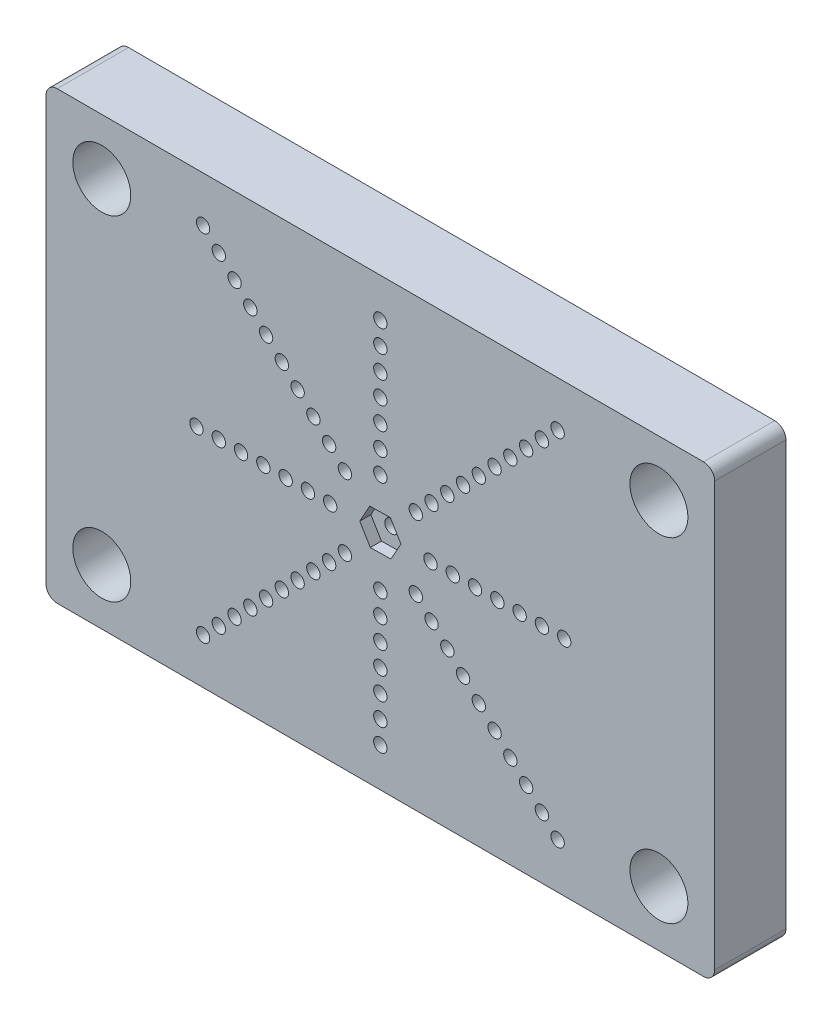
from build123d import *

# Parameters (mm, degrees)
SKETCH1_W           = 300
SKETCH1_H           = 200
SKETCH1_R           = 8
BOSS_EXTRUDE1_DEPTH = 32
SKETCH2_R           = 3
CUT_EXTRUDE2_DEPTH  = 32
CUT_EXTRUDE4_DEPTH  = 16
FILLET4_R           = 5
FILLET8_R           = 10
SKETCH5_R           = 13
CUT_EXTRUDE5_DEPTH  = 90
SKETCH6_R           = 7.5
CUT_EXTRUDE6_DEPTH  = 15
FILLET9_R           = 5
BOSS_EXTRUDE3_DEPTH = 30
FILLET12_R          = 10
SKETCH8_R           = 3
CUT_EXTRUDE7_DEPTH  = 58
CUT_EXTRUDE8_DEPTH  = 5


with BuildPart() as part:
    # Sketch1 → Boss-Extrude1 (new body)
    with BuildSketch(Plane.XY):
        Rectangle(SKETCH1_W, SKETCH1_H)
        with Locations((125, 75)):
            Circle(SKETCH1_R, mode=Mode.SUBTRACT)
        with Locations((125, -75)):
            Circle(SKETCH1_R, mode=Mode.SUBTRACT)
        with Locations((-125, -75)):
            Circle(SKETCH1_R, mode=Mode.SUBTRACT)
        with Locations((-125, 75)):
            Circle(SKETCH1_R, mode=Mode.SUBTRACT)
    extrude(amount=BOSS_EXTRUDE1_DEPTH)

    # Sketch2 → Cut-Extrude2 (cut)
    with BuildSketch(Plane.XY.offset(32)):
        with Locations((82.5, 0)):
            Circle(SKETCH2_R)
        with Locations((58.336309448, -58.336309448)):
            Circle(SKETCH2_R)
        with Locations((51.265241636, -51.265241636)):
            Circle(SKETCH2_R)
        with Locations((44.194173824, -44.194173824)):
            Circle(SKETCH2_R)
        with Locations((37.123106012, -37.123106012)):
            Circle(SKETCH2_R)
        with Locations((30.0520382, -30.0520382)):
            Circle(SKETCH2_R)
        with Locations((22.980970389, -22.980970389)):
            Circle(SKETCH2_R)
        with Locations((22.5, 0)):
            Circle(SKETCH2_R)
        with Locations((32.5, 0)):
            Circle(SKETCH2_R)
        with Locations((42.5, 0)):
            Circle(SKETCH2_R)
        with Locations((52.5, 0)):
            Circle(SKETCH2_R)
        with Locations((62.5, 0)):
            Circle(SKETCH2_R)
        with Locations((72.5, 0)):
            Circle(SKETCH2_R)
        with Locations((15.909902577, -15.909902577)):
            Circle(SKETCH2_R)
        with Locations((65.40737726, -65.40737726)):
            Circle(SKETCH2_R)
        with Locations((0, -82.5)):
            Circle(SKETCH2_R)
        with Locations((0, -72.5)):
            Circle(SKETCH2_R)
        with Locations((0, -62.5)):
            Circle(SKETCH2_R)
        with Locations((0, -52.5)):
            Circle(SKETCH2_R)
        with Locations((0, -42.5)):
            Circle(SKETCH2_R)
        with Locations((0, -32.5)):
            Circle(SKETCH2_R)
        with Locations((0, -22.5)):
            Circle(SKETCH2_R)
        with Locations((72.478445072, -72.478445072)):
            Circle(SKETCH2_R)
        with Locations((-58.336309448, -58.336309448)):
            Circle(SKETCH2_R)
        with Locations((-51.265241636, -51.265241636)):
            Circle(SKETCH2_R)
        with Locations((-44.194173824, -44.194173824)):
            Circle(SKETCH2_R)
        with Locations((-37.123106012, -37.123106012)):
            Circle(SKETCH2_R)
        with Locations((-30.0520382, -30.0520382)):
            Circle(SKETCH2_R)
        with Locations((-22.980970389, -22.980970389)):
            Circle(SKETCH2_R)
        with Locations((-15.909902577, -15.909902577)):
            Circle(SKETCH2_R)
        with Locations((79.549512883, -79.549512883)):
            Circle(SKETCH2_R)
        with Locations((-82.5, 0)):
            Circle(SKETCH2_R)
        with Locations((-72.5, 0)):
            Circle(SKETCH2_R)
        with Locations((-62.5, 0)):
            Circle(SKETCH2_R)
        with Locations((-52.5, 0)):
            Circle(SKETCH2_R)
        with Locations((-42.5, 0)):
            Circle(SKETCH2_R)
        with Locations((-32.5, 0)):
            Circle(SKETCH2_R)
        with Locations((-22.5, 0)):
            Circle(SKETCH2_R)
        with Locations((-58.336309448, 58.336309448)):
            Circle(SKETCH2_R)
        with Locations((-51.265241636, 51.265241636)):
            Circle(SKETCH2_R)
        with Locations((-44.194173824, 44.194173824)):
            Circle(SKETCH2_R)
        with Locations((-37.123106012, 37.123106012)):
            Circle(SKETCH2_R)
        with Locations((-30.0520382, 30.0520382)):
            Circle(SKETCH2_R)
        with Locations((-22.980970389, 22.980970389)):
            Circle(SKETCH2_R)
        with Locations((-15.909902577, 15.909902577)):
            Circle(SKETCH2_R)
        with Locations((0, 82.5)):
            Circle(SKETCH2_R)
        with Locations((0, 72.5)):
            Circle(SKETCH2_R)
        with Locations((0, 62.5)):
            Circle(SKETCH2_R)
        with Locations((0, 52.5)):
            Circle(SKETCH2_R)
        with Locations((0, 42.5)):
            Circle(SKETCH2_R)
        with Locations((0, 32.5)):
            Circle(SKETCH2_R)
        with Locations((0, 22.5)):
            Circle(SKETCH2_R)
        with Locations((58.336309448, 58.336309448)):
            Circle(SKETCH2_R)
        with Locations((51.265241636, 51.265241636)):
            Circle(SKETCH2_R)
        with Locations((44.194173824, 44.194173824)):
            Circle(SKETCH2_R)
        with Locations((37.123106012, 37.123106012)):
            Circle(SKETCH2_R)
        with Locations((30.0520382, 30.0520382)):
            Circle(SKETCH2_R)
        with Locations((22.980970389, 22.980970389)):
            Circle(SKETCH2_R)
        with Locations((15.909902577, 15.909902577)):
            Circle(SKETCH2_R)
        with Locations((-65.40737726, -65.40737726)):
            Circle(SKETCH2_R)
        with Locations((-72.478445072, -72.478445072)):
            Circle(SKETCH2_R)
        with Locations((-79.549512883, -79.549512883)):
            Circle(SKETCH2_R)
        with Locations((-65.40737726, 65.40737726)):
            Circle(SKETCH2_R)
        with Locations((-72.478445072, 72.478445072)):
            Circle(SKETCH2_R)
        with Locations((-79.549512883, 79.549512883)):
            Circle(SKETCH2_R)
        with Locations((65.40737726, 65.40737726)):
            Circle(SKETCH2_R)
        with Locations((72.478445072, 72.478445072)):
            Circle(SKETCH2_R)
        with Locations((79.549512883, 79.549512883)):
            Circle(SKETCH2_R)
    extrude(amount=-CUT_EXTRUDE2_DEPTH, mode=Mode.SUBTRACT)

    # Sketch4 → Cut-Extrude4 (cut)
    with BuildSketch(Plane(origin=(0, 0, 0), x_dir=(-1, 0, 0), z_dir=(0, 0, -1))):
        with BuildLine():
            Line((-7.5, -83.969594837), (-7.5, -18.106601718))
            Line((-7.5, -18.106601718), (-77.238242942, -87.844844659))
            ThreePointArc((-77.238242942, -87.844844659), (-41.99087281, -92.714109158), (-7.5, -83.969594837))
        make_face()
        with BuildLine():
            ThreePointArc((-139.696619787, -7.5), (-125.113286784, -50.428772354), (-91.942153666, -81.335551948))
            Line((-91.942153666, -81.335551948), (-18.106601718, -7.5))
            Line((-18.106601718, -7.5), (-139.696619787, -7.5))
        make_face()
        with BuildLine():
            Line((7.5, -18.106601718), (7.5, -83.969594837))
            ThreePointArc((7.5, -83.969594837), (41.99087281, -92.714109158), (77.238242942, -87.844844659))
            Line((77.238242942, -87.844844659), (7.5, -18.106601718))
        make_face()
        with BuildLine():
            ThreePointArc((-91.942153666, 81.335551948), (-125.113286784, 50.428772354), (-139.696619787, 7.5))
            Line((-139.696619787, 7.5), (-18.106601718, 7.5))
            Line((-18.106601718, 7.5), (-91.942153666, 81.335551948))
        make_face()
        with BuildLine():
            Line((18.106601718, -7.5), (91.942153666, -81.335551948))
            ThreePointArc((91.942153666, -81.335551948), (125.113286784, -50.428772354), (139.696619787, -7.5))
            Line((139.696619787, -7.5), (18.106601718, -7.5))
        make_face()
        with BuildLine():
            ThreePointArc((-7.5, 83.969594837), (-41.99087281, 92.714109158), (-77.238242942, 87.844844659))
            Line((-77.238242942, 87.844844659), (-7.5, 18.106601718))
            Line((-7.5, 18.106601718), (-7.5, 83.969594837))
        make_face()
        with BuildLine():
            Line((18.106601718, 7.5), (139.696619787, 7.5))
            ThreePointArc((139.696619787, 7.5), (125.113286784, 50.428772354), (91.942153666, 81.335551948))
            Line((91.942153666, 81.335551948), (18.106601718, 7.5))
        make_face()
        with BuildLine():
            Line((7.5, 18.106601718), (77.238242942, 87.844844659))
            ThreePointArc((77.238242942, 87.844844659), (41.99087281, 92.714109158), (7.5, 83.969594837))
            Line((7.5, 83.969594837), (7.5, 18.106601718))
        make_face()
    extrude(amount=-CUT_EXTRUDE4_DEPTH, mode=Mode.SUBTRACT)

    # Fillet4
    fillet4_edges = [part.edges().sort_by_distance(p)[0] for p in [
        (-18.106601718, 7.5, 8),
        (-7.5, 18.106601718, 8),
        (7.5, 18.106601718, 8),
        (18.106601718, 7.5, 8),
        (18.106601718, -7.5, 8),
        (7.5, -18.106601718, 8),
        (-7.5, -18.106601718, 8),
        (-18.106601718, -7.5, 8),
    ]]
    fillet(fillet4_edges, radius=FILLET4_R)

    # Fillet8
    fillet8_edges = [part.edges().sort_by_distance(p)[0] for p in [
        (-139.696619787, -7.5, 8),
        (-139.696619787, 7.5, 8),
        (-77.238242942, 87.844844659, 8),
        (7.5, 83.969594837, 8),
        (-7.5, 83.969594837, 8),
        (77.238242942, 87.844844659, 8),
        (139.696619787, -7.5, 8),
        (139.696619787, 7.5, 8),
        (77.238242942, -87.844844659, 8),
        (7.5, -83.969594837, 8),
        (-7.5, -83.969594837, 8),
        (-77.238242942, -87.844844659, 8),
    ]]
    fillet(fillet8_edges, radius=FILLET8_R)

    # Sketch5 → Cut-Extrude5 (cut)
    with BuildSketch(Plane(origin=(0, 0, 0), x_dir=(-1, 0, 0), z_dir=(0, 0, -1))):
        with Locations((-125, -75)):
            Circle(SKETCH5_R)
        with Locations((125, -75)):
            Circle(SKETCH5_R)
        with Locations((125, 75)):
            Circle(SKETCH5_R)
        with Locations((-125, 75)):
            Circle(SKETCH5_R)
    extrude(amount=-CUT_EXTRUDE5_DEPTH, mode=Mode.SUBTRACT)

    # Sketch6 → Cut-Extrude6 (cut)
    with BuildSketch(Plane(origin=(0, 0, 0), x_dir=(-1, 0, 0), z_dir=(0, 0, -1))):
        Circle(SKETCH6_R)
    extrude(amount=-CUT_EXTRUDE6_DEPTH, mode=Mode.SUBTRACT)

    # Fillet9
    fillet9_edges = [part.edges().sort_by_distance(p)[0] for p in [
        (150, 100, 16),
        (150, -100, 16),
        (-150, -100, 16),
        (-150, 100, 16),
    ]]
    fillet(fillet9_edges, radius=FILLET9_R)

    # Sketch7 → Boss-Extrude3 (add)
    with BuildSketch(Plane(origin=(0, 0, 0), x_dir=(-1, 0, 0), z_dir=(0, 0, -1))):
        with BuildLine():
            ThreePointArc((-91.942153666, 81.335551948), (-117.523587833, 52.409838387), (-137.905270787, 19.612068966))
            ThreePointArc((-137.905270787, 19.612068966), (-121.618970117, 55.459512943), (-91.942153666, 81.335551948))
        make_face()
        with BuildLine():
            ThreePointArc((-91.942153666, -81.335551948), (-117.523587833, -52.409838387), (-137.905270787, -19.612068966))
            ThreePointArc((-137.905270787, -19.612068966), (-121.618970117, -55.459512943), (-91.942153666, -81.335551948))
        make_face()
        with BuildLine():
            ThreePointArc((91.942153666, 81.335551948), (117.523587833, 52.409838387), (137.905270787, 19.612068966))
            ThreePointArc((137.905270787, 19.612068966), (121.618970117, 55.459512943), (91.942153666, 81.335551948))
        make_face()
        with BuildLine():
            ThreePointArc((91.942153666, -81.335551948), (117.523587833, -52.409838387), (137.905270787, -19.612068966))
            ThreePointArc((137.905270787, -19.612068966), (121.618970117, -55.459512943), (91.942153666, -81.335551948))
        make_face()
    extrude(amount=-BOSS_EXTRUDE3_DEPTH)

    # Fillet12
    fillet12_edges = [part.edges().sort_by_distance(p)[0] for p in [
        (91.942153666, 81.335551948, 8),
        (-91.942153666, 81.335551948, 8),
        (91.942153666, -81.335551948, 8),
        (-91.942153666, -81.335551948, 8),
    ]]
    fillet(fillet12_edges, radius=FILLET12_R)

    # Sketch8 → Cut-Extrude7 (cut)
    with BuildSketch(Plane(origin=(0, 0, 15), x_dir=(-1, 0, 0), z_dir=(0, 0, -1))):
        Circle(SKETCH8_R)
    extrude(amount=-CUT_EXTRUDE7_DEPTH, mode=Mode.SUBTRACT)

    # Sketch9 → Cut-Extrude8 (cut)
    with BuildSketch(Plane.XY.offset(32)):
        Polygon((-4.497069145, -8.069058337), (4.739474932, -7.92910529), (9.236544077, 0.139953046), (4.497069145, 8.069058337), (-4.739474932, 7.92910529), (-9.236544077, -0.139953046), align=None)
    extrude(amount=-CUT_EXTRUDE8_DEPTH, mode=Mode.SUBTRACT)


solid = part.part
